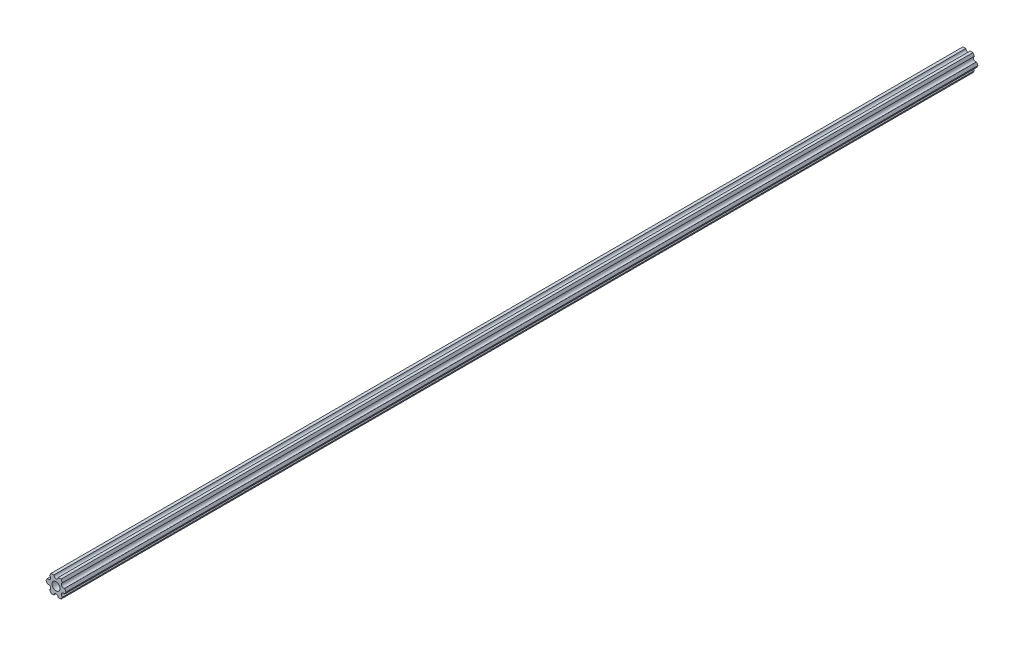
from build123d import *

# Parameters (mm, degrees)
SKETCH1_R           = 2.9337
BOSS_EXTRUDE1_DEPTH = 666.75


with BuildPart() as part:
    # Sketch1 → Boss-Extrude1 (new body)
    with BuildSketch(Plane.XY):
        with BuildLine():
            Line((-1.587500385, 6.349999904), (-3.666174594, 6.349999778))
            Line((-3.666174594, 6.349999778), (-4.70551159, 4.549815043))
            ThreePointArc((-4.70551159, 4.549815043), (-4.12444613, 2.38124975), (-6.293011423, 1.80018429))
            Line((-6.293011423, 1.80018429), (-7.332348419, -4.44e-07))
            Line((-7.332348419, -4.44e-07), (-6.293011205, -1.800185053))
            ThreePointArc((-6.293011205, -1.800185053), (-4.124445841, -2.38125025), (-4.705511038, -4.549815614))
            Line((-4.705511038, -4.549815614), (-3.666173825, -6.350000222))
            Line((-3.666173825, -6.350000222), (-1.587499615, -6.350000096))
            ThreePointArc((-1.587499615, -6.350000096), (2.89e-07, -4.7625), (1.587500385, -6.349999904))
            Line((1.587500385, -6.349999904), (3.666174594, -6.349999778))
            Line((3.666174594, -6.349999778), (4.70551159, -4.549815043))
            ThreePointArc((4.70551159, -4.549815043), (4.12444613, -2.38124975), (6.293011423, -1.80018429))
            Line((6.293011423, -1.80018429), (7.332348419, 4.44e-07))
            Line((7.332348419, 4.44e-07), (6.293011205, 1.800185053))
            ThreePointArc((6.293011205, 1.800185053), (4.124445841, 2.38125025), (4.705511038, 4.549815614))
            Line((4.705511038, 4.549815614), (3.666173825, 6.350000222))
            Line((3.666173825, 6.350000222), (1.587499615, 6.350000096))
            ThreePointArc((1.587499615, 6.350000096), (-2.89e-07, 4.7625), (-1.587500385, 6.349999904))
        make_face()
        Circle(SKETCH1_R, mode=Mode.SUBTRACT)
    extrude(amount=BOSS_EXTRUDE1_DEPTH)


solid = part.part
